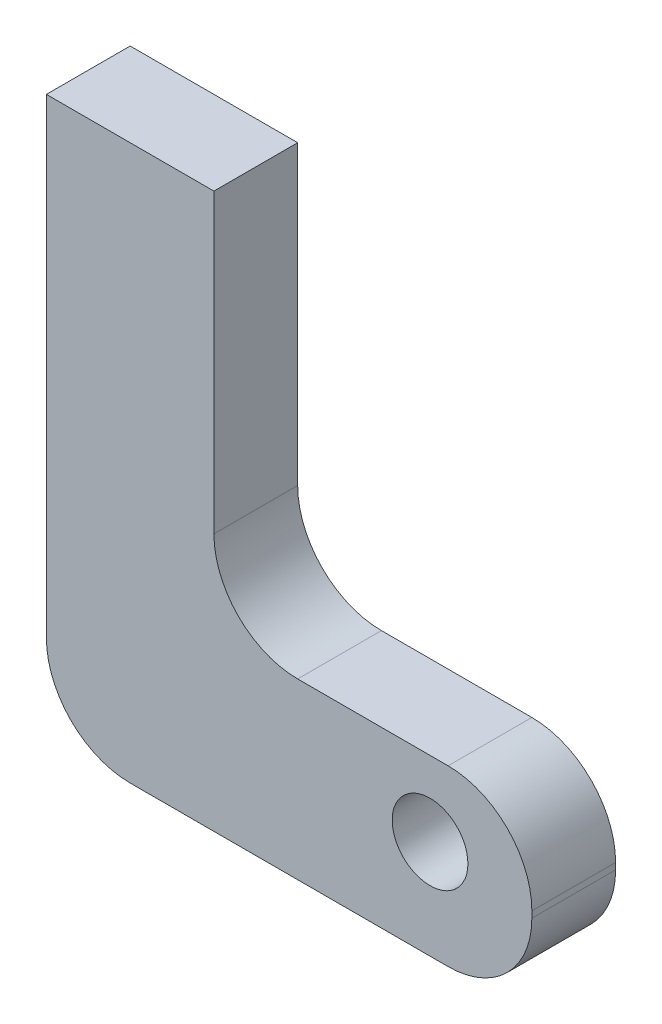
from build123d import *

# Parameters (mm, degrees)
SKETCH1_R           = 2.8702
BOSS_EXTRUDE1_DEPTH = 6.35
FILLET1_R           = 6.35


with BuildPart() as part:
    # Sketch1 → Boss-Extrude1 (new body)
    with BuildSketch(Plane.XY):
        Polygon((113.949884677, 0), (126.649884677, 0), (126.649884677, -6.35), (126.649884677, -28.855984936), (150.753776805, -28.855984936), (150.753776805, -42.040179878), (126.649884677, -42.040179878), (113.949884677, -42.040179878), (113.949884677, -6.35), align=None)
        with Locations((143.035641266, -34.539684717)):
            Circle(SKETCH1_R, mode=Mode.SUBTRACT)
    extrude(amount=BOSS_EXTRUDE1_DEPTH)

    # Fillet1
    fillet1_edges = [part.edges().sort_by_distance(p)[0] for p in [
        (126.649884677, -28.855984936, 3.175),
        (150.753776805, -28.855984936, 3.175),
        (150.753776805, -42.040179878, 3.175),
        (113.949884677, -42.040179878, 3.175),
    ]]
    fillet(fillet1_edges, radius=FILLET1_R)


solid = part.part
